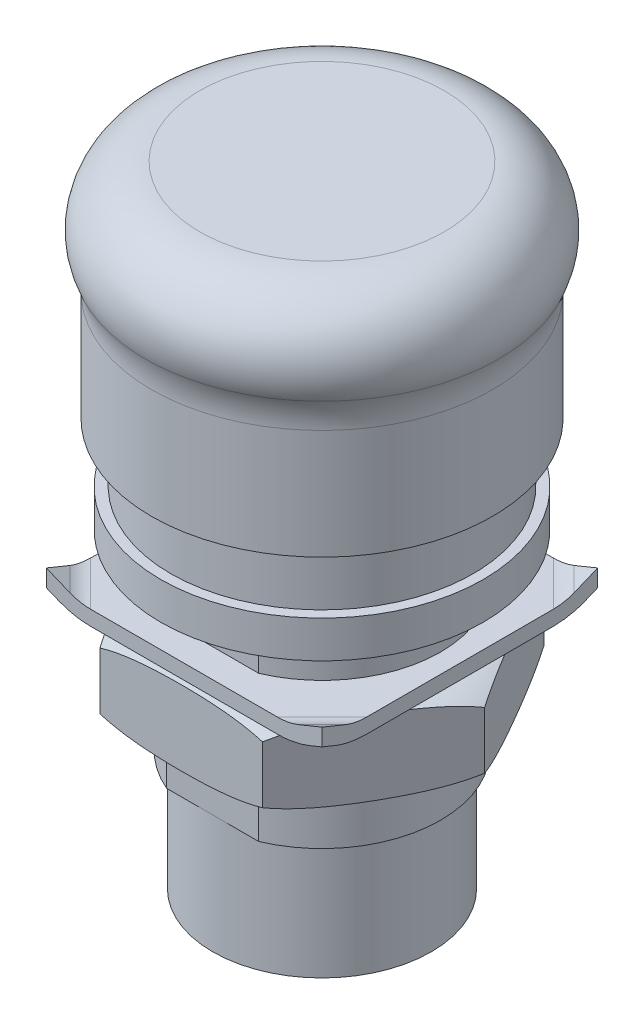
from build123d import *

# Parameters (mm, degrees)
CUT_EXTRUDE1_DEPTH              = 21
BOSS_EXTRUDE1_DEPTH             = 1
BOSS_EXTRUDE3_REACH             = 39.588
BOSS_EXTRUDE3_DIRECTION_2_REACH = 39.588
SKETCH7_R                       = 8
BOSS_EXTRUDE4_DEPTH             = 5.35


with BuildPart() as part:
    # Sketch1 → Revolve-Thin1 (revolve)
    with BuildSketch(Plane.XY, mode=Mode.PRIVATE) as revolve_thin1_sk:
        with BuildLine():
            Line((0, 0), (8.25, 0))
            ThreePointArc((8.25, 0), (11.59622489, -1.808475648), (11.916666667, -5.598610508))
            ThreePointArc((11.916666667, -5.598610508), (11.605274948, -6.576252916), (11.5, -7.596873642))
            Line((11.5, -7.596873642), (11.5, -15))
            Line((11.5, -15), (10.5, -15))
            Line((10.5, -15), (10.5, -7.596873642))
            ThreePointArc((10.5, -7.596873642), (10.626329938, -6.372128771), (11, -5.198957881))
            ThreePointArc((11, -5.198957881), (10.759668668, -2.356356736), (8.25, -1))
            Line((8.25, -1), (0, -1))
            Line((0, -1), (0, 0))
        make_face()
    revolve(revolve_thin1_sk.sketch.rotate(Axis((0, -42.5, 0), (0, 1, 0)), 90), axis=Axis((0, -42.5, 0), (0, 1, 0)))


with BuildPart() as body_2:
    # Sketch2 → Revolve1 (revolve)
    with BuildSketch(Plane.XY, mode=Mode.PRIVATE) as revolve1_sk:
        Polygon((0, -42.5), (7.375, -42.5), (7.375, -34.5), (8, -34.5), (8, -21.5), (10.875, -21.5), (10.875, -19), (10.2, -19), (10.2, -12.5), (0, -12.5), align=None)
    revolve(revolve1_sk.sketch.rotate(Axis((0, -12.5, 0), (0, -1, 0)), 90), axis=Axis((0, -12.5, 0), (0, -1, 0)))

    # Sketch3 → Cut-Extrude1 (cut)
    with BuildSketch(Plane.XZ.offset(42.5)):
        with BuildLine():
            ThreePointArc((3.099899192, 7.375), (0, 8), (-3.099899192, 7.375))
            Line((-3.099899192, 7.375), (3.099899192, 7.375))
        make_face()
        with BuildLine():
            Line((3.099899192, -7.375), (-3.099899192, -7.375))
            ThreePointArc((-3.099899192, -7.375), (0, -8), (3.099899192, -7.375))
        make_face()
    extrude(amount=-CUT_EXTRUDE1_DEPTH, mode=Mode.SUBTRACT)


with BuildPart() as body_3:
    # Sketch4 → Boss-Extrude1 (new body)
    with BuildSketch(Plane.XZ.offset(24.675)):
        with BuildLine():
            Line((-6.3, 9.3), (-9.3, 6.3))
            Line((-9.3, 6.3), (-9.3, 0))
            Line((-9.3, 0), (-8, 0))
            ThreePointArc((-8, 0), (-6.663302242, 4.427234264), (-3.099899192, 7.375))
            Line((-3.099899192, 7.375), (0, 7.375))
            Line((0, 7.375), (0, 9.3))
            Line((0, 9.3), (-6.3, 9.3))
        make_face()
    extrude(amount=BOSS_EXTRUDE1_DEPTH)

    # Boss-Extrude3: up to this face of the body (flat: up to its plane)
    boss_extrude3_end = Plane(body_3.part.faces().sort_by_distance((-3.15, -25.175, 9.3))[0])
    # Sketch5 → Boss-Extrude3 (add, up to the picked face)
    with BuildSketch(Plane(origin=(-7.8, -24.675, 7.8), x_dir=(0.7071067811865476, 0, -0.7071067811865476), z_dir=(0.7071067811865476, 0, 0.7071067811865476)), mode=Mode.PRIVATE) as boss_extrude3_sk1:
        with BuildLine():
            Line((-2.732050808, 1.267949192), (-3.232050808, 0.401923789))
            Line((-3.232050808, 0.401923789), (-1.5, -0.598076211))
            ThreePointArc((-1.5, -0.598076211), (-0.776457135, -0.897777479), (0, -1))
            Line((0, -1), (0, 0))
            ThreePointArc((0, 0), (-0.51763809, 0.068148347), (-1, 0.267949192))
            Line((-1, 0.267949192), (-2.732050808, 1.267949192))
        make_face()
    boss_extrude3_tool1 = split(extrude(boss_extrude3_sk1.sketch, amount=BOSS_EXTRUDE3_REACH, mode=Mode.PRIVATE), bisect_by=boss_extrude3_end, keep=Keep.BOTH, mode=Mode.PRIVATE)
    add(boss_extrude3_tool1.solids().sort_by(Axis((-8.885675, -24.638373, 8.885675), (0.7071067811865476, 0, 0.7071067811865476)))[0])

    # Boss-Extrude3 direction 2: up to this face of the body (flat: up to its plane)
    boss_extrude3_direction_2_end = Plane(body_3.part.faces().sort_by_distance((-9.3, -25.175, 3.15))[0])
    # Sketch5 → Boss-Extrude3 direction 2 (add, up to the picked face)
    with BuildSketch(Plane(origin=(-7.8, -24.675, 7.8), x_dir=(0.7071067811865476, 0, -0.7071067811865476), z_dir=(0.7071067811865476, 0, 0.7071067811865476)), mode=Mode.PRIVATE) as boss_extrude3_direction_2_sk1:
        with BuildLine():
            Line((-2.732050808, 1.267949192), (-3.232050808, 0.401923789))
            Line((-3.232050808, 0.401923789), (-1.5, -0.598076211))
            ThreePointArc((-1.5, -0.598076211), (-0.776457135, -0.897777479), (0, -1))
            Line((0, -1), (0, 0))
            ThreePointArc((0, 0), (-0.51763809, 0.068148347), (-1, 0.267949192))
            Line((-1, 0.267949192), (-2.732050808, 1.267949192))
        make_face()
    boss_extrude3_direction_2_tool1 = split(extrude(boss_extrude3_direction_2_sk1.sketch, amount=-BOSS_EXTRUDE3_DIRECTION_2_REACH, mode=Mode.PRIVATE), bisect_by=boss_extrude3_direction_2_end, keep=Keep.BOTH, mode=Mode.PRIVATE)
    add(boss_extrude3_direction_2_tool1.solids().sort_by(Axis((-8.885675, -24.638373, 8.885675), (-0.7071067811865476, 0, -0.7071067811865476)))[0])


with BuildPart() as body_4:
    # Mirror1: mirrored copy
    add(body_3.part.mirror(Plane(origin=(0, -25.675, 0), x_dir=(0, 0, 1), z_dir=(-1, 0, 0))))


with BuildPart() as body_5:
    # Mirror2: mirrored copy
    add(body_3.part.mirror(Plane(origin=(0, -25.675, 0), x_dir=(1, 0, 0), z_dir=(0, 0, -1))))


with BuildPart() as body_6:
    # Mirror2 2: mirrored copy
    add(body_4.part.mirror(Plane(origin=(0, -25.675, 0), x_dir=(1, 0, 0), z_dir=(0, 0, -1))))


with BuildPart() as body_4_1:
    add(body_4.part)

    # Combine1: union body 6, body 5, body 3
    add(body_6.part)
    add(body_5.part)
    add(body_3.part)


with BuildPart() as body_4_2:
    # Sketch7 → Boss-Extrude4 (new body)
    with BuildSketch(Plane.XZ.offset(25.675)):
        Polygon((5.484827557, 9.5), (-5.484827557, 9.5), (-10.969655115, 0), (-5.484827557, -9.5), (5.484827557, -9.5), (10.969655115, 0), align=None)
        with Locations(Location((0, 0, 0), (0, 0, 270))):
            Circle(SKETCH7_R, mode=Mode.SUBTRACT)
    extrude(amount=BOSS_EXTRUDE4_DEPTH)

    # Sketch8 → Cut-Revolve2 (revolve, cut)
    with BuildSketch(Plane.XY, mode=Mode.PRIVATE) as cut_revolve2_sk:
        with BuildLine():
            Line((-8.227241336, -25.675), (-10.969655115, -25.675))
            Line((-10.969655115, -25.675), (-10.969655115, -26.425))
            ThreePointArc((-10.969655115, -26.425), (-9.648801512, -25.865880605), (-8.227241336, -25.675))
        make_face()
        with BuildLine():
            Line((-8.227241336, -31.025), (-10.969655115, -31.025))
            Line((-10.969655115, -31.025), (-10.969655115, -30.275))
            ThreePointArc((-10.969655115, -30.275), (-9.648801512, -30.834119395), (-8.227241336, -31.025))
        make_face()
    revolve(cut_revolve2_sk.sketch.rotate(Axis((0, -25.675, 0), (0, -1, 0)), 270), axis=Axis((0, -25.675, 0), (0, -1, 0)), mode=Mode.SUBTRACT)


solid = Compound([part.part, body_2.part, body_4_1.part, body_4_2.part])
